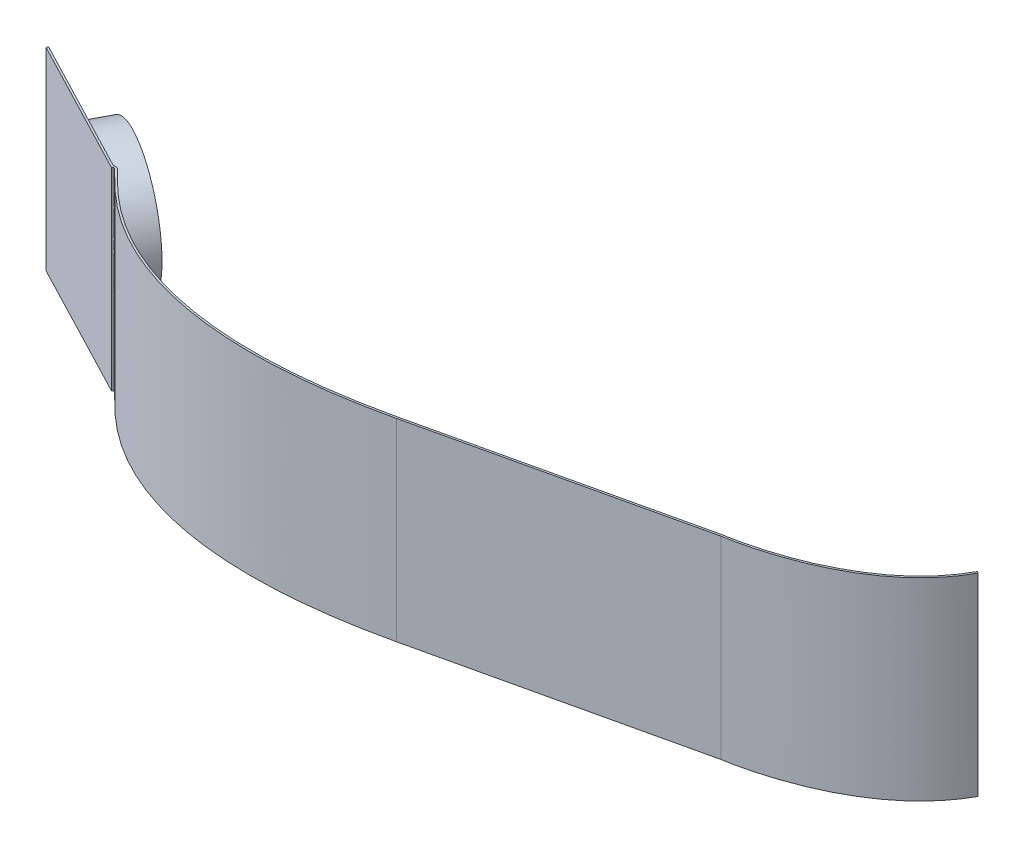
from build123d import *

# Parameters (mm, degrees)
BOSS_EXTRUDE1_DEPTH = 10
SKETCH4_R           = 3.5
BOSS_EXTRUDE2_DEPTH = 2


with BuildPart() as part:
    # Sketch3 → Boss-Extrude1 (new body)
    with BuildSketch(Plane(origin=(0, 0, 0), x_dir=(1, 0, 0), z_dir=(0, 1, 0))):
        with BuildLine():
            Line((-8.295163099, -4.989581051), (-21.944112767, -8.105054222))
            add(Edge.make_bspline(
                [(-21.944112767, -8.105054222), (-36.599398609, -11.450231029), (-40.464002181, -3.390864029), (-40.529101438, -4.251627045)],
                knots=[0, 0, 0, 0, 1, 1, 1, 1], degree=3))
            Line((-40.529101438, -4.251627045), (-47.623112326, -0.55365334))
            Line((-47.623112326, -0.55365334), (-47.576887655, -0.464978204))
            Line((-47.576887655, -0.464978204), (-40.572148999, -4.116415983))
            add(Edge.make_bspline(
                [(-21.966366147, -8.007561725), (-22.396066998, -8.105644105), (-23.275286064, -8.290086355), (-24.914987793, -8.571024206), (-26.836762685, -8.786692696), (-28.918808138, -8.849067278), (-31.418816098, -8.708583968), (-34.045077269, -8.17987225), (-36.475914515, -7.195214648), (-38.261605993, -6.073523184), (-39.273877377, -5.201221667), (-39.837186402, -4.64714179), (-40.143219474, -4.326665428), (-40.323221416, -4.165849337), (-40.415698885, -4.086477252), (-40.536237964, -4.086979076), (-40.572148999, -4.116415983)],
                knots=[0, 0, 0, 0, 0.03017949, 0.060358979, 0.120717959, 0.181076938, 0.241435918, 0.362153877, 0.482871836, 0.603589795, 0.724307754, 0.784666733, 0.845025713, 0.905384692, 0.935564182, 0.965743672, 0.965743672, 0.965743672, 0.965743672], degree=3))
            Line((-21.966366147, -8.007561725), (-8.315768165, -4.891712315))
            add(Edge.make_bspline(
                [(-0.088012232, 0.047474699), (-0.356397835, -0.450079081), (-1.032836633, -1.386242187), (-2.68336885, -2.850637944), (-4.597654291, -3.834538286), (-6.308371252, -4.430253868), (-7.197320722, -4.666535762), (-7.744281816, -4.788081914), (-8.053905871, -4.848215909), (-8.265623567, -4.884669732), (-8.289529935, -4.886138886), (-8.315768165, -4.891712315)],
                knots=[0, 0, 0, 0, 0.124588701, 0.249177401, 0.498354802, 0.622943503, 0.747532204, 0.809826554, 0.872120904, 0.934415255, 0.996709605, 0.996709605, 0.996709605, 0.996709605], degree=3))
            Line((-0.088012232, 0.047474699), (0, 0))
            add(Edge.make_bspline(
                [(0, 0), (-2.239715341, -4.15215579), (-8.297544207, -4.987143929), (-8.295163099, -4.989581051)],
                knots=[0, 0, 0, 0, 1, 1, 1, 1], degree=3))
        make_face()
    extrude(amount=BOSS_EXTRUDE1_DEPTH)

    # Sketch4 → Boss-Extrude2 (add)
    with BuildSketch(Plane(origin=(-10.356443465, 0, 19.867291804), x_dir=(-0.8867513609427561, 0, -0.4622467132021277), z_dir=(0.4622467132021276, 0, -0.886751360942756))):
        with Locations(Location((38.024271907, 5, 0), (0, 0, 180))):
            Circle(SKETCH4_R)
    extrude(amount=BOSS_EXTRUDE2_DEPTH)


solid = part.part
